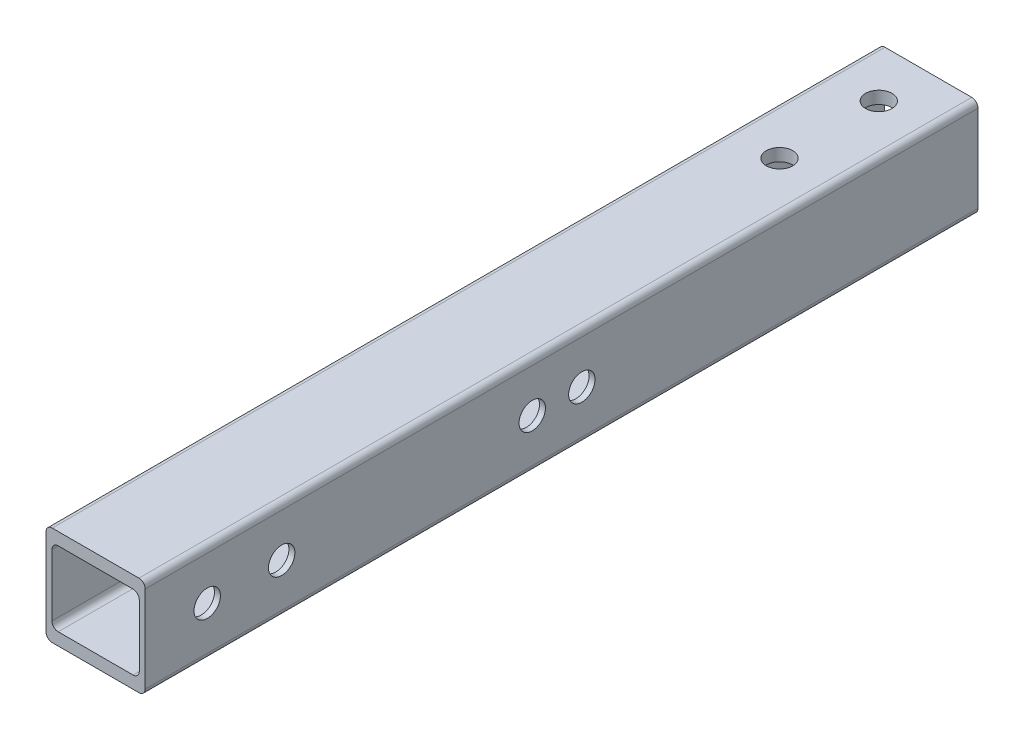
from build123d import *

# Parameters (mm, degrees)
SKETCH3_W               = 25.4
SKETCH3_H               = 25.4
SKETCH3_W_2             = 22.352
SKETCH3_H_2             = 19.05
BOSS_EXTRUDE1_DEPTH     = 68.48094
FILLET1_R               = 1.6002
F_1_4_CLEARANCE_HOLE2_D = 6.7564
F_1_4_CLEARANCE_HOLE3_D = 6.7564
BOSS_EXTRUDE2_START     = 76.2
BOSS_EXTRUDE2_DEPTH     = 76.2
SKETCH17_R              = 3.3782
CUT_EXTRUDE3_DEPTH      = 148.441596571


with BuildPart() as part:
    # Sketch3 → Boss-Extrude1 (new, symmetric)
    with BuildSketch(Plane.XY):
        Rectangle(SKETCH3_W, SKETCH3_H)
        Rectangle(SKETCH3_W_2, SKETCH3_H_2, mode=Mode.SUBTRACT)
    extrude(amount=BOSS_EXTRUDE1_DEPTH, both=True)

    # Fillet1
    fillet1_edges = [part.edges().sort_by_distance(p)[0] for p in [
        (-11.176, -9.525, 0),
        (11.176, -9.525, 0),
        (-11.176, 9.525, 0),
        (11.176, 9.525, 0),
        (-12.7, -12.7, 0),
        (12.7, -12.7, 0),
        (-12.7, 12.7, 0),
        (12.7, 12.7, 0),
    ]]
    fillet(fillet1_edges, radius=FILLET1_R)

    # 1/4 Clearance Hole2 (through all)
    with Locations(Plane.ZY.offset(12.7)):
        with Locations((32.92094, 0), (45.62094, 0)):
            Hole(F_1_4_CLEARANCE_HOLE2_D / 2)

    # 1/4 Clearance Hole3 (through all)
    with Locations(Plane(origin=(0, 12.7, 0), x_dir=(1, 0, 0), z_dir=(0, 1, 0))):
        with Locations((0, 55.78094), (0, 30.38094)):
            Hole(F_1_4_CLEARANCE_HOLE3_D / 2)

    # Sketch16 → Boss-Extrude2 (add)
    with BuildSketch(Plane.XY.offset(68.48094).offset(BOSS_EXTRUDE2_START)):
        with BuildLine():
            Line((-12.7, 11.0998), (-12.7, -11.0998))
            ThreePointArc((-12.7, -11.0998), (-12.231312271, -12.231312271), (-11.0998, -12.7))
            Line((-11.0998, -12.7), (11.0998, -12.7))
            ThreePointArc((11.0998, -12.7), (12.231312271, -12.231312271), (12.7, -11.0998))
            Line((12.7, -11.0998), (12.7, 11.0998))
            ThreePointArc((12.7, 11.0998), (12.231312271, 12.231312271), (11.0998, 12.7))
            Line((11.0998, 12.7), (-11.0998, 12.7))
            ThreePointArc((-11.0998, 12.7), (-12.231312271, 12.231312271), (-12.7, 11.0998))
        make_face()
        with BuildLine():
            Line((11.176, -7.9248), (11.176, 7.9248))
            ThreePointArc((11.176, 7.9248), (10.707312271, 9.056312271), (9.5758, 9.525))
            Line((9.5758, 9.525), (-9.5758, 9.525))
            ThreePointArc((-9.5758, 9.525), (-10.707312271, 9.056312271), (-11.176, 7.9248))
            Line((-11.176, 7.9248), (-11.176, -7.9248))
            ThreePointArc((-11.176, -7.9248), (-10.707312271, -9.056312271), (-9.5758, -9.525))
            Line((-9.5758, -9.525), (9.5758, -9.525))
            ThreePointArc((9.5758, -9.525), (10.707312271, -9.056312271), (11.176, -7.9248))
        make_face(mode=Mode.SUBTRACT)
    extrude(amount=-BOSS_EXTRUDE2_DEPTH)

    # Sketch17 → Cut-Extrude3 (cut, through all)
    with BuildSketch(Plane(origin=(12.7, 0, 0), x_dir=(0, 0, -1), z_dir=(1, 0, 0))):
        with Locations((-109.75594, 0)):
            Circle(SKETCH17_R)
        with Locations((-128.80594, 0)):
            Circle(SKETCH17_R)
    extrude(amount=-CUT_EXTRUDE3_DEPTH, mode=Mode.SUBTRACT)


solid = part.part
